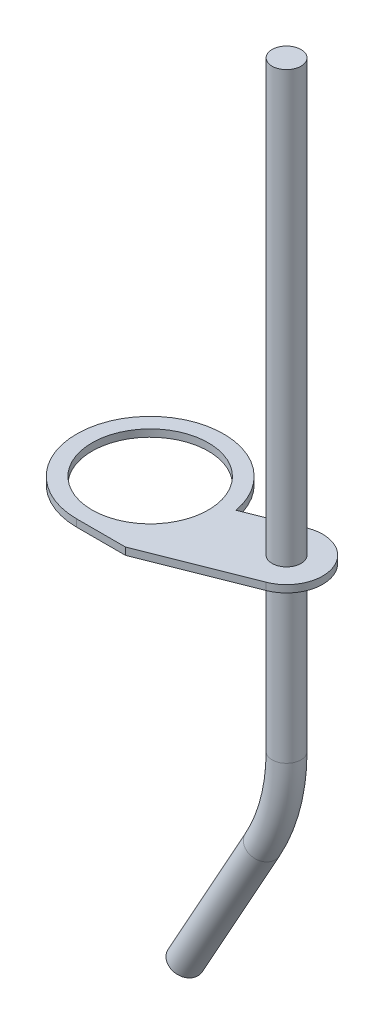
from build123d import *

# Parameters (mm, degrees)
SKETCH4_R           = 2
BOSS_EXTRUDE1_DEPTH = 0.5
CUT_EXTRUDE1_REACH  = 68.966
SKETCH6_R           = 8.04


with BuildPart() as part:
    # Sweep1: sweep along a path in Sketch2
    with BuildLine(Plane.XY) as sweep1_path:
        Line((0, 0), (0, -83))
        ThreePointArc((0, -83), (-0.841224391, -89.596719602), (-3.311053985, -95.771208226))
        Line((-3.311053985, -95.771208226), (-14, -115))
    # Sketch4 → Sweep1 (sweep)
    with BuildSketch(Plane(origin=(0, 0, 0), x_dir=(1, 0, 0), z_dir=(0, 1, 0))):
        Circle(SKETCH4_R)
    sweep(path=sweep1_path.line)

    # Sketch5 → Boss-Extrude1 (add, symmetric)
    with BuildSketch(Plane(origin=(0, -60, 0), x_dir=(1, 0, 0), z_dir=(0, 1, 0))):
        with BuildLine():
            Line((-18.84, -10.16), (-12.115048494, -10.16))
            Line((-12.115048494, -10.16), (1.836495151, -4.650514548))
            ThreePointArc((1.836495151, -4.650514548), (4.650514548, 1.836495151), (-1.836495151, 4.650514548))
            Line((-1.836495151, 4.650514548), (-8.855227327, 1.878806714))
            ThreePointArc((-8.855227327, 1.878806714), (-26.660302942, 6.486020497), (-18.84, -10.16))
        make_face()
    extrude(amount=BOSS_EXTRUDE1_DEPTH, both=True)

    # Sketch6 → Cut-Extrude1 (cut, up to next)
    with BuildSketch(Plane(origin=(0, -59.5, 0), x_dir=(1, 0, 0), z_dir=(0, 1, 0)), mode=Mode.PRIVATE) as cut_extrude1_sk1:
        with Locations(Location((-18.84, 0, 0), (0, 0, 270))):
            Circle(SKETCH6_R)
    cut_extrude1_tool1 = extrude(cut_extrude1_sk1.sketch, amount=-CUT_EXTRUDE1_REACH, mode=Mode.PRIVATE) & part.part
    add(cut_extrude1_tool1.solids().sort_by_distance((-18.84, -59.5, 0))[0], mode=Mode.SUBTRACT)


solid = part.part
